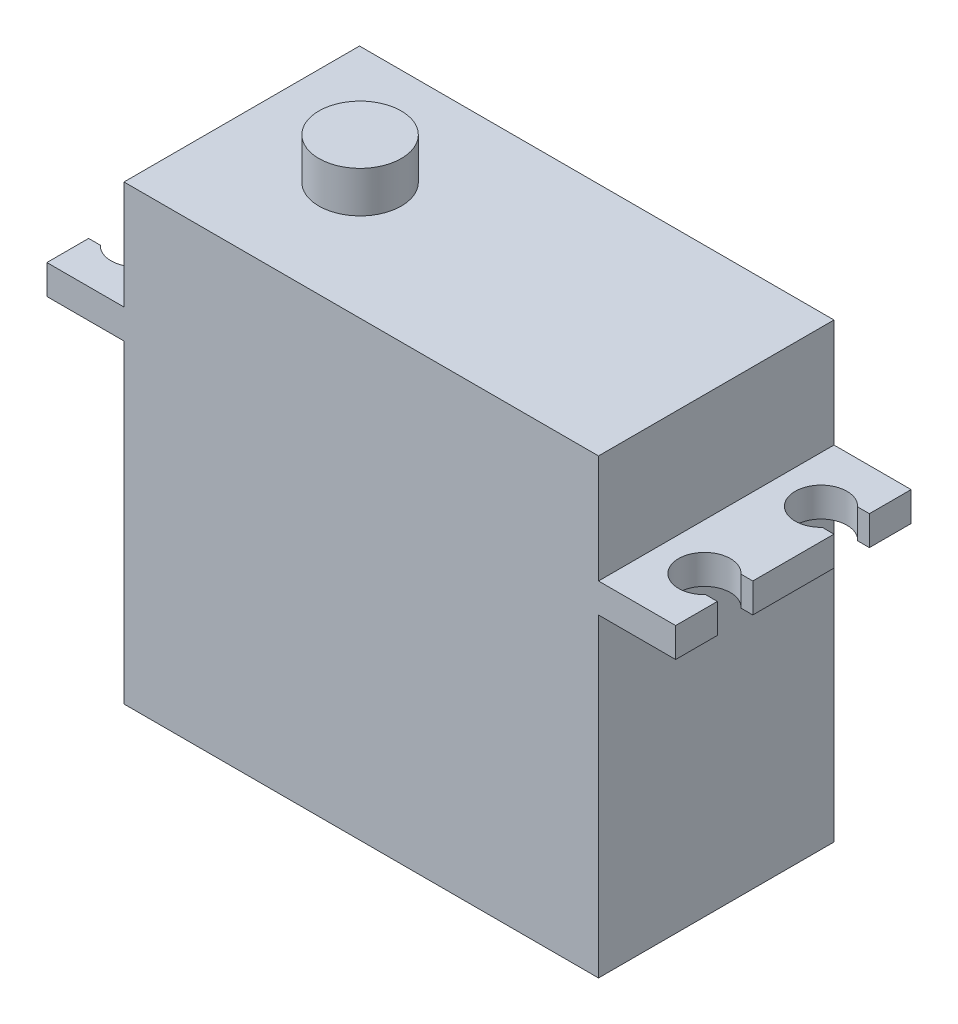
from build123d import *

# Parameters (mm, degrees)
SKETCH1_W           = 40.3
SKETCH1_H           = 20
BOSS_EXTRUDE1_DEPTH = 38.4
BOSS_EXTRUDE3_START = -11.7
BOSS_EXTRUDE3_DEPTH = 2.5
SKETCH5_R           = 3.5
BOSS_EXTRUDE4_DEPTH = 3.5


with BuildPart() as part:
    # Sketch1 → Boss-Extrude1 (new body)
    with BuildSketch(Plane(origin=(0, 0, 0), x_dir=(1, 0, 0), z_dir=(0, 1, 0))):
        Rectangle(SKETCH1_W, SKETCH1_H)
    extrude(amount=BOSS_EXTRUDE1_DEPTH)

    # Sketch3 → Boss-Extrude3 (add)
    with BuildSketch(Plane(origin=(0, 38.4, 0), x_dir=(1, 0, 0), z_dir=(0, 1, 0)).offset(BOSS_EXTRUDE3_START)):
        with BuildLine():
            Line((-26.7, 10), (26.7, 10))
            Line((26.7, 10), (26.7, 6.455172275))
            Line((26.7, 6.455172275), (25.704511273, 6.455172275))
            ThreePointArc((25.704511273, 6.455172275), (21.9, 4.95), (25.704511273, 3.444827725))
            Line((25.704511273, 3.444827725), (26.7, 3.444827725))
            Line((26.7, 3.444827725), (26.7, -3.444827725))
            Line((26.7, -3.444827725), (25.704511273, -3.444827725))
            ThreePointArc((25.704511273, -3.444827725), (21.9, -4.95), (25.704511273, -6.455172275))
            Line((25.704511273, -6.455172275), (26.7, -6.455172275))
            Line((26.7, -6.455172275), (26.7, -10))
            Line((26.7, -10), (-26.7, -10))
            Line((-26.7, -10), (-26.7, -6.455172275))
            Line((-26.7, -6.455172275), (-25.704511273, -6.455172275))
            ThreePointArc((-25.704511273, -6.455172275), (-21.9, -4.95), (-25.704511273, -3.444827725))
            Line((-25.704511273, -3.444827725), (-26.7, -3.444827725))
            Line((-26.7, -3.444827725), (-26.7, 3.444827725))
            Line((-26.7, 3.444827725), (-25.704511273, 3.444827725))
            ThreePointArc((-25.704511273, 3.444827725), (-21.9, 4.95), (-25.704511273, 6.455172275))
            Line((-25.704511273, 6.455172275), (-26.7, 6.455172275))
            Line((-26.7, 6.455172275), (-26.7, 10))
        make_face()
    extrude(amount=BOSS_EXTRUDE3_DEPTH)

    # Sketch5 → Boss-Extrude4 (add)
    with BuildSketch(Plane(origin=(0, 38.4, 0), x_dir=(1, 0, 0), z_dir=(0, 1, 0))):
        with Locations(Location((-10.1, 0, 0), (0, 0, 270))):
            Circle(SKETCH5_R)
    extrude(amount=BOSS_EXTRUDE4_DEPTH)


solid = part.part
